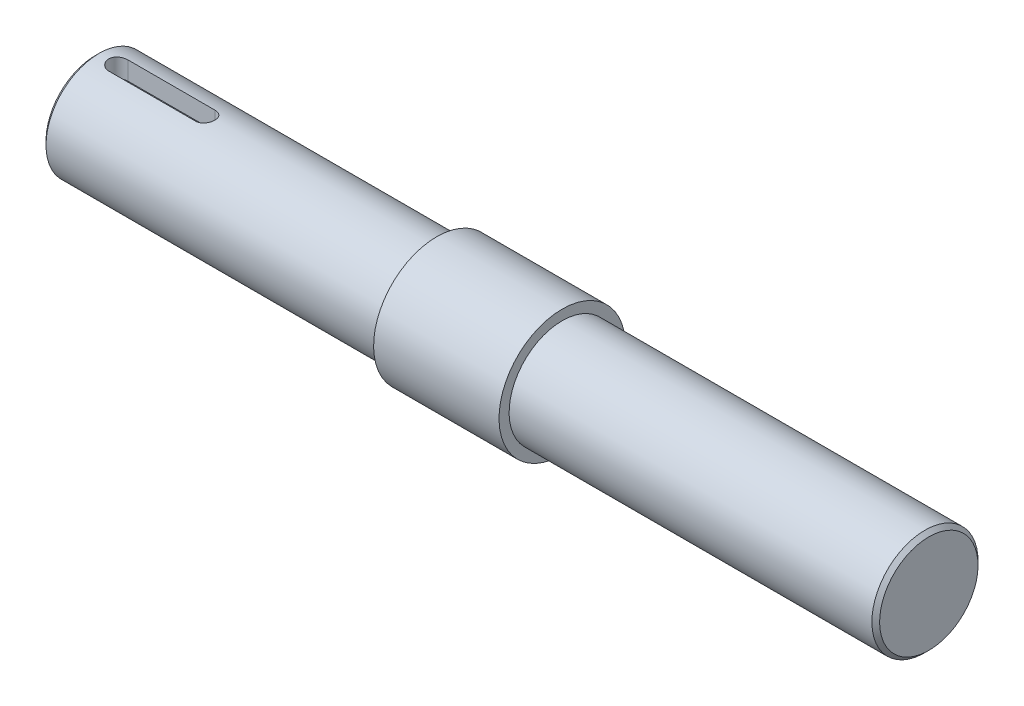
from build123d import *

# Parameters (mm, degrees)
CHAFL_N1_SIZE         = 2
CORTAR_EXTRUIR1_DEPTH = 10


with BuildPart() as part:
    # Croquis1 → Revolución1 (revolve)
    with BuildSketch(Plane.XY):
        Polygon((0, 0), (0, 27.5), (177, 27.5), (177, 32.725), (242, 32.725), (242, 27.5), (432, 27.5), (432, 0), align=None)
    revolve(axis=Axis((432, 0, 0), (-1, 0, 0)))

    # Chaflán1
    chafl_n1_edges = [part.edges().sort_by_distance(p)[0] for p in [
        (432, -27.5, 0),
        (0, -27.5, 0),
    ]]
    chamfer(chafl_n1_edges, length=CHAFL_N1_SIZE)

    # Croquis2 → Cortar-Extruir1 (cut)
    with BuildSketch(Plane(origin=(0, 27.5, 0), x_dir=(1, 0, 0), z_dir=(0, 1, 0))):
        with BuildLine():
            Line((57, 5), (12, 5))
            ThreePointArc((12, 5), (7, 0), (12, -5))
            Line((12, -5), (57, -5))
            ThreePointArc((57, -5), (62, 0), (57, 5))
        make_face()
    extrude(amount=-CORTAR_EXTRUIR1_DEPTH, mode=Mode.SUBTRACT)


solid = part.part
